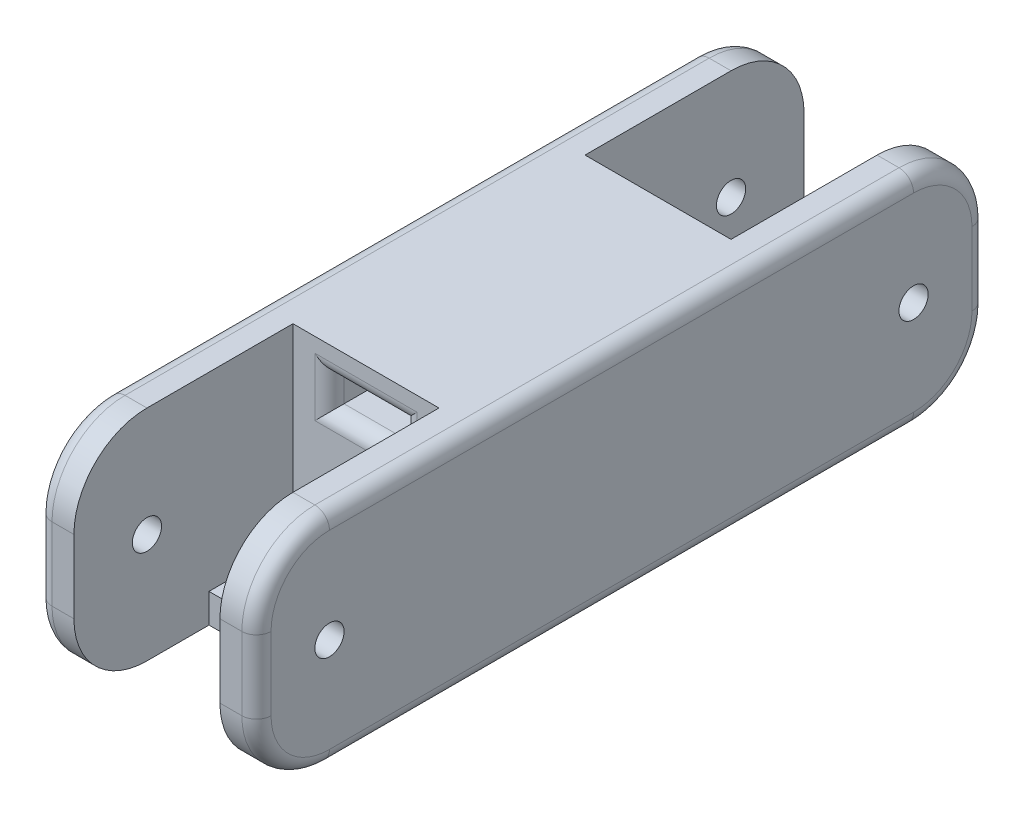
from build123d import *

# Parameters (mm, degrees)
BOTTOM_SECTION_BASE_SKETCH_W     = 15
BOTTOM_SECTION_BASE_SKETCH_H     = 15
BOTTOM_SECTION_EXTRUDE_DEPTH     = 50
HINGE_CUTOUT_SKETCH_W            = 10
HINGE_CUTOUT_SKETCH_H            = 15
HINGE_CUTOUT_EXTRUDED_CUT_DEPTH  = 15
HINGE_HOLE_SKETCH_R              = 1
HINGE_HOLE_EXTRUDED_CUT_DEPTH    = 53.737557774
HINGER_CORNER_FILLETS_R          = 5
STYLE_FILLETS_R                  = 1
ROUTING_HOLES_SKETCH_W           = 5
ROUTING_HOLES_SKETCH_H           = 2
ROUTING_HOLES_EXTRUDED_CUT_DEPTH = 52.112620751
BACKING_SKETCH_W                 = 10
BACKING_SKETCH_H                 = 2
BACKING_EXTRUDE_DEPTH            = 5.75
ROUTING_FILLETS_R                = 1


with BuildPart() as part:
    # Bottom Section Base Sketch → Bottom Section Extrude (new body)
    with BuildSketch(Plane.XY):
        Rectangle(BOTTOM_SECTION_BASE_SKETCH_W, BOTTOM_SECTION_BASE_SKETCH_H)
    extrude(amount=BOTTOM_SECTION_EXTRUDE_DEPTH)

    # Hinge Cutout Sketch → Hinge Cutout Extruded Cut (cut)
    with BuildSketch(Plane.XY):
        Rectangle(HINGE_CUTOUT_SKETCH_W, HINGE_CUTOUT_SKETCH_H)
    hinge_cutout_extruded_cut = extrude(amount=HINGE_CUTOUT_EXTRUDED_CUT_DEPTH, mode=Mode.SUBTRACT)

    # Hinge Hole Sketch → Hinge Hole Extruded Cut (cut, through all)
    with BuildSketch(Plane(origin=(7.5, 0, 0), x_dir=(0, 0, -1), z_dir=(1, 0, 0))):
        with Locations((-5, 0)):
            Circle(HINGE_HOLE_SKETCH_R)
    hinge_hole_extruded_cut = extrude(amount=-HINGE_HOLE_EXTRUDED_CUT_DEPTH, mode=Mode.SUBTRACT)

    # Hinge and Hole Cutout Mirror: Hinge Cutout Extruded Cut, Hinge Hole Extruded Cut across plane
    add(hinge_cutout_extruded_cut.mirror(Plane.XY.offset(25)), mode=Mode.SUBTRACT)
    add(hinge_hole_extruded_cut.mirror(Plane.XY.offset(25)), mode=Mode.SUBTRACT)

    # Hinger Corner Fillets
    hinger_corner_fillets_edges = [part.edges().sort_by_distance(p)[0] for p in [
        (6.25, -7.5, 0),
        (-6.25, 7.5, 0),
        (-6.25, -7.5, 50),
        (-6.25, 7.5, 50),
        (6.25, -7.5, 50),
        (-6.25, -7.5, 0),
        (6.25, 7.5, 0),
        (6.25, 7.5, 50),
    ]]
    fillet(hinger_corner_fillets_edges, radius=HINGER_CORNER_FILLETS_R)

    # Style Fillets
    style_fillets_edges = [part.edges().sort_by_distance(p)[0] for p in [
        (7.5, 0, 50),
        (7.5, 7.5, 25),
        (-7.5, 7.5, 25),
        (7.5, 0, 0),
        (7.5, -7.5, 25),
        (7.5, 6.035533906, 1.464466094),
        (7.5, -6.035533906, 1.464466094),
        (7.5, -6.035533906, 48.535533906),
        (7.5, 6.035533906, 48.535533906),
        (-7.5, -7.5, 25),
        (-7.5, 0, 50),
        (-7.5, 0, 0),
        (-7.5, -6.035533906, 1.464466094),
        (-7.5, 6.035533906, 1.464466094),
        (-7.5, 6.035533906, 48.535533906),
        (-7.5, -6.035533906, 48.535533906),
    ]]
    fillet(style_fillets_edges, radius=STYLE_FILLETS_R)

    # Routing Holes Sketch → Routing Holes Extruded Cut (cut, through all)
    with BuildSketch(Plane.XY):
        with Locations((0, 4.5)):
            Rectangle(ROUTING_HOLES_SKETCH_W, ROUTING_HOLES_SKETCH_H)
        with Locations((0, -4.5)):
            Rectangle(ROUTING_HOLES_SKETCH_W, ROUTING_HOLES_SKETCH_H)
    extrude(amount=ROUTING_HOLES_EXTRUDED_CUT_DEPTH, mode=Mode.SUBTRACT)

    # Backing Sketch → Backing Extrude (add)
    with BuildSketch(Plane.XY.offset(35)):
        with Locations((0, -6.5)):
            Rectangle(BACKING_SKETCH_W, BACKING_SKETCH_H)
    extrude(amount=BACKING_EXTRUDE_DEPTH)

    # Routing Fillets
    routing_fillets_edges = [part.edges().sort_by_distance(p)[0] for p in [
        (-2.5, -4.5, 35),
        (0, -3.5, 35),
        (2.5, -4.5, 35),
        (0, 5.5, 35),
        (2.5, 4.5, 35),
        (0, 3.5, 35),
        (-2.5, 4.5, 35),
        (-2.5, 4.5, 15),
        (0, 3.5, 15),
        (2.5, 4.5, 15),
        (0, 5.5, 15),
        (0, -5.5, 15),
        (2.5, -4.5, 15),
        (0, -3.5, 15),
        (-2.5, -4.5, 15),
    ]]
    fillet(routing_fillets_edges, radius=ROUTING_FILLETS_R)


solid = part.part
